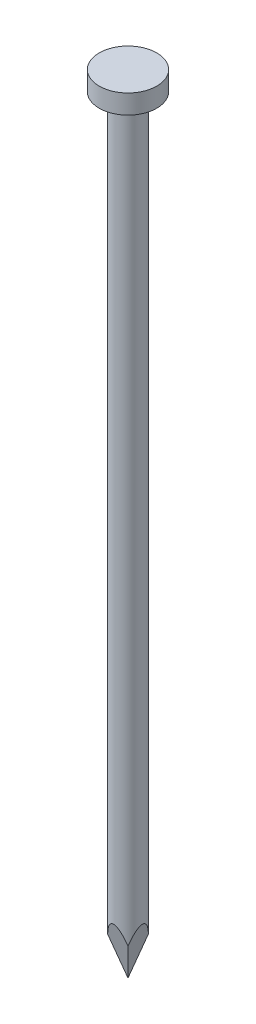
from build123d import *

# Parameters (mm, degrees)
SKETCH_1_R               = 0.75
EXTRUDE_1_DEPTH          = 40
SKETCH_2_R               = 1.5
EXTRUDE_2_DEPTH          = 1
CUT_EXTRUDE_2_DEPTH      = 41.056210505
CUT_EXTRUDE_2_DEPTH_BACK = 41.056210505
CUT_EXTRUDE_3_DEPTH      = 41.056210505
CUT_EXTRUDE_3_DEPTH_BACK = 41.056210505


with BuildPart() as part:
    # Эскиз1 → Бобышка-Вытянуть1 (new body)
    with BuildSketch(Plane(origin=(0, 0, 0), x_dir=(1, 0, 0), z_dir=(0, 1, 0))):
        with Locations(Location((0, 0, 0), (0, 0, 270))):
            Circle(SKETCH_1_R)
    extrude(amount=-EXTRUDE_1_DEPTH)

    # Эскиз2 → Бобышка-Вытянуть2 (add)
    with BuildSketch(Plane(origin=(0, 0, 0), x_dir=(1, 0, 0), z_dir=(0, 1, 0))):
        with Locations(Location((0, 0, 0), (0, 0, 270))):
            Circle(SKETCH_2_R)
    extrude(amount=EXTRUDE_2_DEPTH)

    # Эскиз5 → Вырез-Вытянуть2 (cut, two sides: drawn at the far end of the back side and taken through both)
    with BuildSketch(Plane(origin=(0, 0, 0), x_dir=(0, 0, -1), z_dir=(1, 0, 0)).offset(-CUT_EXTRUDE_2_DEPTH_BACK)):
        Polygon((-1.201318644, -35.516617784), (-1.201318644, -40.516617784), (1.201318644, -40.516617784), (1.201318644, -35.516617784), (0, -40), align=None)
    extrude(amount=CUT_EXTRUDE_2_DEPTH + CUT_EXTRUDE_2_DEPTH_BACK, mode=Mode.SUBTRACT)

    # Эскиз7 → Вырез-Вытянуть3 (cut, two sides: drawn at the far end of the back side and taken through both)
    with BuildSketch(Plane.XY.offset(-CUT_EXTRUDE_3_DEPTH_BACK)):
        Polygon((-1.267511878, -35.269581272), (-1.267511878, -40.269581272), (1.267511878, -40.269581272), (1.267511878, -35.269581272), (0, -40), align=None)
    extrude(amount=CUT_EXTRUDE_3_DEPTH + CUT_EXTRUDE_3_DEPTH_BACK, mode=Mode.SUBTRACT)


solid = part.part
